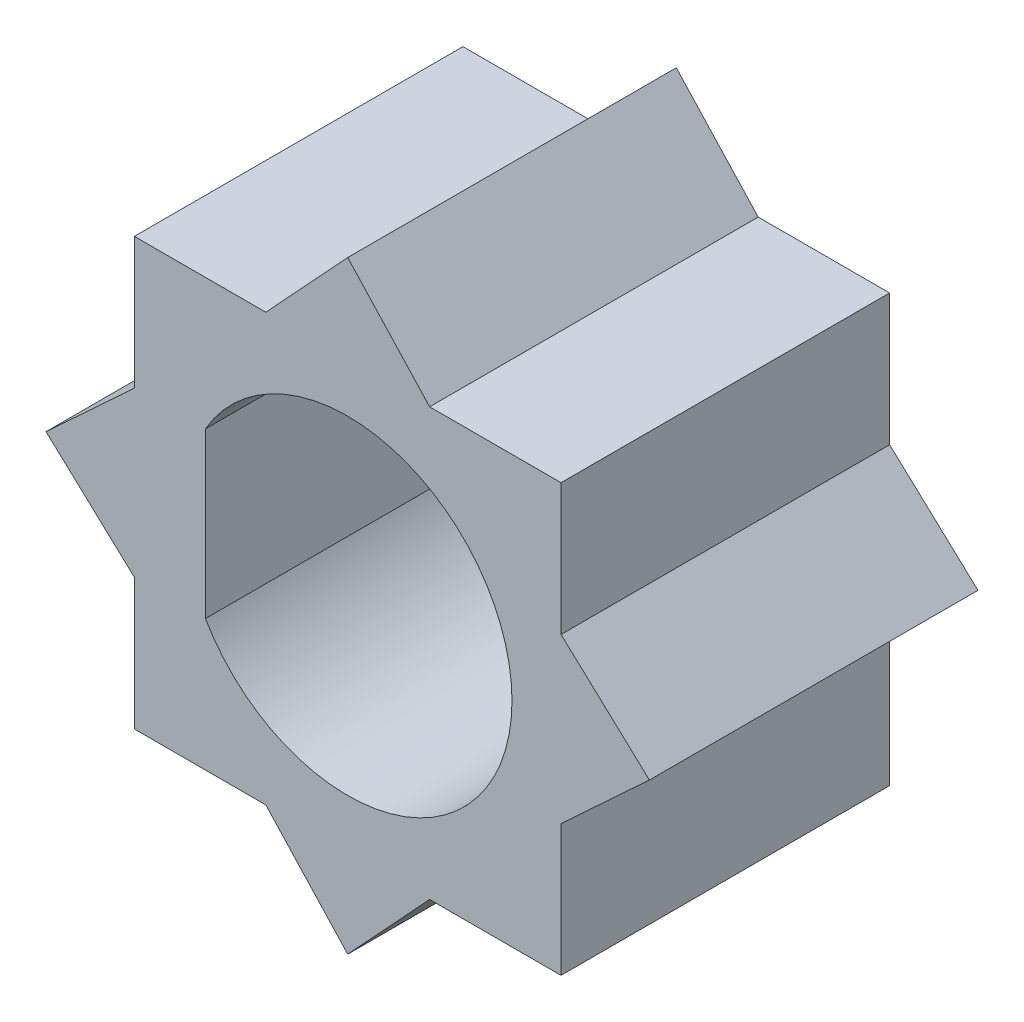
from build123d import *

# Parameters (mm, degrees)
BOSS_EXTRU_1_DEPTH = 6


with BuildPart() as part:
    # Esquisse1 → Boss.-Extru.1 (new body)
    with BuildSketch(Plane.XY):
        Polygon((-14.937221854, 10.148336377), (-17.337221854, 10.148336377), (-17.337221854, 7.748336377), (-18.950778827, 6.252865249), (-17.337221854, 4.757394121), (-17.337221854, 2.357394121), (-14.937221854, 2.357394121), (-13.441750726, 0.743837148), (-11.946279598, 2.357394121), (-9.546279598, 2.357394121), (-9.546279598, 4.757394121), (-7.932722625, 6.252865249), (-9.546279598, 7.748336377), (-9.546279598, 10.148336377), (-11.946279598, 10.148336377), (-13.441750726, 11.761893351), align=None)
        with BuildLine():
            Line((-16.039826937, 4.752865249), (-16.039826937, 7.752865249))
            ThreePointArc((-16.039826937, 7.752865249), (-10.441750726, 6.252865249), (-16.039826937, 4.752865249))
        make_face(mode=Mode.SUBTRACT)
    extrude(amount=BOSS_EXTRU_1_DEPTH)


solid = part.part
